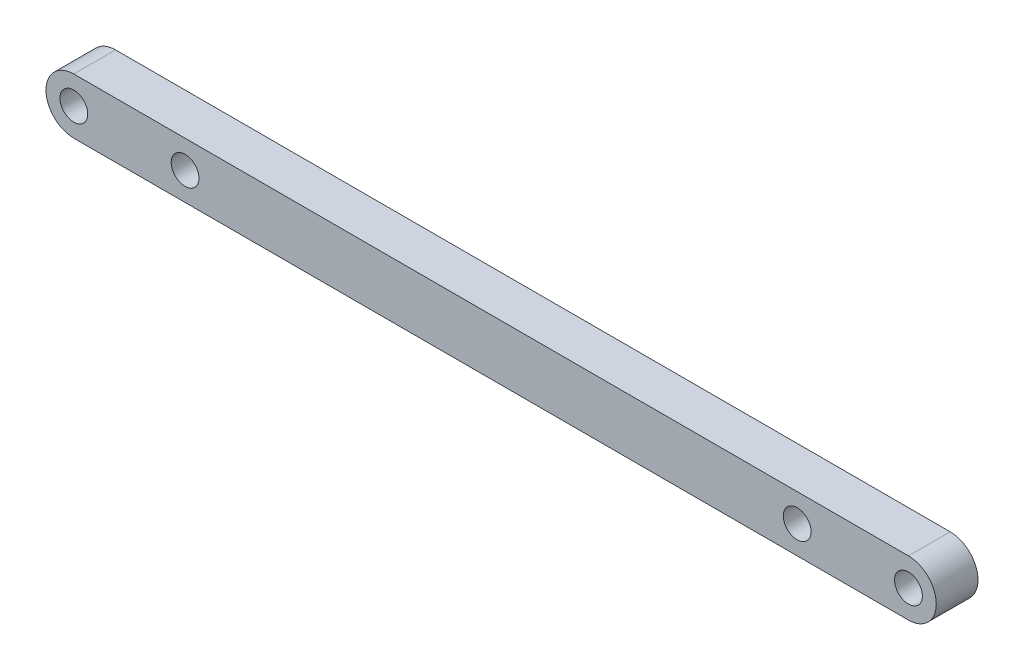
from build123d import *

# Parameters (mm, degrees)
SKETCH1_R           = 1
BOSS_EXTRUDE1_DEPTH = 3


with BuildPart() as part:
    # Sketch1 → Boss-Extrude1 (new body)
    with BuildSketch(Plane.XY):
        with BuildLine():
            Line((0, 2), (60, 2))
            ThreePointArc((60, 2), (62, 0), (60, -2))
            Line((60, -2), (0, -2))
            ThreePointArc((0, -2), (-2, 0), (0, 2))
        make_face()
        Circle(SKETCH1_R, mode=Mode.SUBTRACT)
        with Locations((8, 0)):
            Circle(SKETCH1_R, mode=Mode.SUBTRACT)
        with Locations(Location((52, 0, 0), (0, 0, 180))):
            Circle(SKETCH1_R, mode=Mode.SUBTRACT)
        with Locations(Location((60, 0, 0), (0, 0, 180))):
            Circle(SKETCH1_R, mode=Mode.SUBTRACT)
    extrude(amount=BOSS_EXTRUDE1_DEPTH)


solid = part.part
